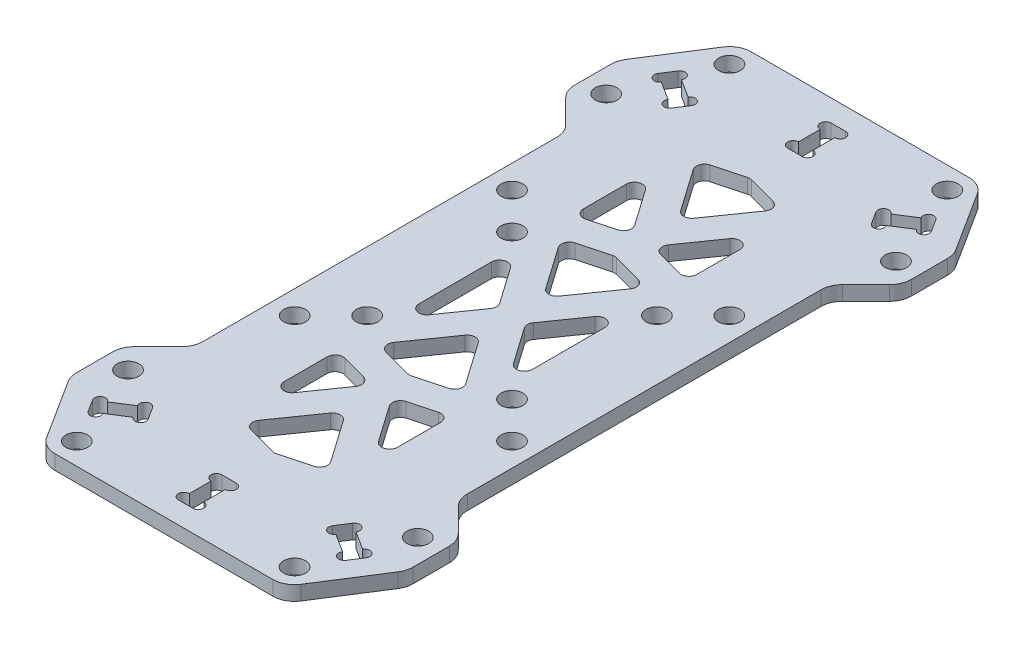
from build123d import *

# Parameters (mm, degrees)
SKETCH11_R               = 1.5
BOSS_EXTRUDE1_DEPTH      = 2
MIRROR11_COPY_1_SKETCH_R = 1.5
MIRROR11_COPY_1_DEPTH    = 2


with BuildPart() as part:
    # Sketch11 → Boss-Extrude1 (new body)
    with BuildSketch(Plane(origin=(0, 0, 0), x_dir=(1, 0, 0), z_dir=(0, 1, 0))):
        with BuildLine():
            Line((0, 48.049), (0, 45.049))
            Line((0, 45.049), (1, 45.049))
            ThreePointArc((1, 45.049), (1.75, 44.299), (1, 43.549))
            Line((1, 43.549), (1, 40.549))
            ThreePointArc((1, 40.549), (1.75, 39.799), (1, 39.049))
            Line((1, 39.049), (0, 39.049))
            Line((0, 39.049), (0, 32.80309693))
            ThreePointArc((0, 32.80309693), (0.143578811, 32.793686277), (0.28470095, 32.765615339))
            Line((0.28470095, 32.765615339), (4.345061591, 31.677644984))
            ThreePointArc((4.345061591, 31.677644984), (5.094022524, 30.991348733), (4.96142789, 29.984192495))
            Line((4.96142789, 29.984192495), (0.901067249, 24.185396539))
            ThreePointArc((0.901067249, 24.185396539), (0.507923475, 23.840618702), (0, 23.716330619))
            Line((0, 23.716330619), (0, 14.172763066))
            ThreePointArc((0, 14.172763066), (0.143578811, 14.163352413), (0.28470095, 14.135281475))
            Line((0.28470095, 14.135281475), (4.34193597, 13.048148628))
            ThreePointArc((4.34193597, 13.048148628), (5.090896903, 12.361852376), (4.958302269, 11.354696139))
            Line((4.958302269, 11.354696139), (0.901067249, 5.560364032))
            ThreePointArc((0.901067249, 5.560364032), (0.507923475, 5.215586196), (0, 5.091298112))
            Line((0, 5.091298112), (0, 0))
            Line((0, 0), (2.133608841, 0))
            ThreePointArc((2.133608841, 0), (2.184520195, 0.330776379), (2.332541592, 0.63093408))
            Line((2.332541592, 0.63093408), (5.833579283, 5.63093408))
            ThreePointArc((5.833579283, 5.63093408), (7.065422911, 6.049088646), (7.834646532, 5))
            Line((7.834646532, 5), (7.834646532, 0))
            Line((7.834646532, 0), (18.23, 0))
            Line((18.23, 0), (18.23, 24.405210912))
            ThreePointArc((18.23, 24.405210912), (18.458361402, 25.553261209), (19.108679656, 26.526531256))
            Line((19.108679656, 26.526531256), (22.351320344, 29.769171943))
            ThreePointArc((22.351320344, 29.769171943), (23.001638598, 30.742441989), (23.23, 31.890492286))
            Line((23.23, 31.890492286), (23.23, 36.890492286))
            ThreePointArc((23.23, 36.890492286), (23.110149563, 37.729979328), (22.760174337, 38.502391111))
            Line((22.760174337, 38.502391111), (17.562631701, 46.660898825))
            ThreePointArc((17.562631701, 46.660898825), (16.47542367, 47.679180267), (15.032457363, 48.049))
            Line((15.032457363, 48.049), (0, 48.049))
        make_face()
        with Locations(Location((15.032457363, 45.049, 0), (0, 0, 270))):
            Circle(SKETCH11_R, mode=Mode.SUBTRACT)
        with Locations(Location((10, 10, 0), (0, 0, 270))):
            Circle(SKETCH11_R, mode=Mode.SUBTRACT)
        with Locations(Location((20, 33, 0), (0, 0, 270))):
            Circle(SKETCH11_R, mode=Mode.SUBTRACT)
        with Locations(Location((15, 15, 0), (0, 0, 270))):
            Circle(SKETCH11_R, mode=Mode.SUBTRACT)
        with BuildLine():
            Line((13.99733048, 38.298608253), (16.527504818, 39.910507078))
            ThreePointArc((16.527504818, 39.910507078), (16.757073696, 40.946025369), (17.792591987, 40.716456491))
            Line((17.792591987, 40.716456491), (18.867191203, 39.029673599))
            ThreePointArc((18.867191203, 39.029673599), (18.637622325, 37.994155308), (17.602104035, 38.223724186))
            Line((17.602104035, 38.223724186), (15.071929697, 36.611825361))
            ThreePointArc((15.071929697, 36.611825361), (14.842360819, 35.576307071), (13.806842528, 35.805875949))
            Line((13.806842528, 35.805875949), (12.732243312, 37.49265884))
            ThreePointArc((12.732243312, 37.49265884), (12.96181219, 38.528177131), (13.99733048, 38.298608253))
        make_face(mode=Mode.SUBTRACT)
        with BuildLine():
            Line((7.834646532, 17.686932285), (7.834646532, 23.625032507))
            ThreePointArc((7.834646532, 23.625032507), (7.065422911, 24.674121152), (5.833579283, 24.255966587))
            Line((5.833579283, 24.255966587), (2.332541592, 19.255966587))
            ThreePointArc((2.332541592, 19.255966587), (2.199946958, 18.248810349), (2.948907891, 17.562514098))
            Line((2.948907891, 17.562514098), (6.449945582, 16.624413876))
            ThreePointArc((6.449945582, 16.624413876), (7.404284104, 16.81424361), (7.834646532, 17.686932285))
        make_face(mode=Mode.SUBTRACT)
    boss_extrude1 = extrude(amount=BOSS_EXTRUDE1_DEPTH)

    # Mirror10: Boss-Extrude1 across plane
    add(boss_extrude1.mirror(Plane(origin=(0, 0, 0), x_dir=(0, 0, 1), z_dir=(1, 0, 0))))

    # Mirror11: Boss-Extrude1 across plane
    add(boss_extrude1.mirror(Plane.XY))

    # Mirror11 copy 1 sketch → Mirror11 copy 1 (add)
    with BuildSketch(Plane(origin=(0, 0, 0), x_dir=(-1, 0, 0), z_dir=(0, 1, 0))):
        with BuildLine():
            Line((0, 48.049), (0, 45.049))
            Line((0, 45.049), (1, 45.049))
            ThreePointArc((1, 45.049), (1.75, 44.299), (1, 43.549))
            Line((1, 43.549), (1, 40.549))
            ThreePointArc((1, 40.549), (1.75, 39.799), (1, 39.049))
            Line((1, 39.049), (0, 39.049))
            Line((0, 39.049), (0, 32.80309693))
            ThreePointArc((0, 32.80309693), (0.143578811, 32.793686277), (0.28470095, 32.765615339))
            Line((0.28470095, 32.765615339), (4.345061591, 31.677644984))
            ThreePointArc((4.345061591, 31.677644984), (5.094022524, 30.991348733), (4.96142789, 29.984192495))
            Line((4.96142789, 29.984192495), (0.901067249, 24.185396539))
            ThreePointArc((0.901067249, 24.185396539), (0.507923475, 23.840618702), (0, 23.716330619))
            Line((0, 23.716330619), (0, 14.172763066))
            ThreePointArc((0, 14.172763066), (0.143578811, 14.163352413), (0.28470095, 14.135281475))
            Line((0.28470095, 14.135281475), (4.34193597, 13.048148628))
            ThreePointArc((4.34193597, 13.048148628), (5.090896903, 12.361852376), (4.958302269, 11.354696139))
            Line((4.958302269, 11.354696139), (0.901067249, 5.560364032))
            ThreePointArc((0.901067249, 5.560364032), (0.507923475, 5.215586196), (0, 5.091298112))
            Line((0, 5.091298112), (0, 0))
            Line((0, 0), (2.133608841, 0))
            ThreePointArc((2.133608841, 0), (2.184520195, 0.330776379), (2.332541592, 0.63093408))
            Line((2.332541592, 0.63093408), (5.833579283, 5.63093408))
            ThreePointArc((5.833579283, 5.63093408), (7.065422911, 6.049088646), (7.834646532, 5))
            Line((7.834646532, 5), (7.834646532, 0))
            Line((7.834646532, 0), (18.23, 0))
            Line((18.23, 0), (18.23, 24.405210912))
            ThreePointArc((18.23, 24.405210912), (18.458361402, 25.553261209), (19.108679656, 26.526531256))
            Line((19.108679656, 26.526531256), (22.351320344, 29.769171943))
            ThreePointArc((22.351320344, 29.769171943), (23.001638598, 30.742441989), (23.23, 31.890492286))
            Line((23.23, 31.890492286), (23.23, 36.890492286))
            ThreePointArc((23.23, 36.890492286), (23.110149563, 37.729979328), (22.760174337, 38.502391111))
            Line((22.760174337, 38.502391111), (17.562631701, 46.660898825))
            ThreePointArc((17.562631701, 46.660898825), (16.47542367, 47.679180267), (15.032457363, 48.049))
            Line((15.032457363, 48.049), (0, 48.049))
        make_face()
        with Locations(Location((15.032457363, 45.049, 0), (0, 0, 270))):
            Circle(MIRROR11_COPY_1_SKETCH_R, mode=Mode.SUBTRACT)
        with Locations(Location((10, 10, 0), (0, 0, 270))):
            Circle(MIRROR11_COPY_1_SKETCH_R, mode=Mode.SUBTRACT)
        with Locations(Location((20, 33, 0), (0, 0, 270))):
            Circle(MIRROR11_COPY_1_SKETCH_R, mode=Mode.SUBTRACT)
        with Locations(Location((15, 15, 0), (0, 0, 270))):
            Circle(MIRROR11_COPY_1_SKETCH_R, mode=Mode.SUBTRACT)
        with BuildLine():
            Line((13.99733048, 38.298608253), (16.527504818, 39.910507078))
            ThreePointArc((16.527504818, 39.910507078), (16.757073696, 40.946025369), (17.792591987, 40.716456491))
            Line((17.792591987, 40.716456491), (18.867191203, 39.029673599))
            ThreePointArc((18.867191203, 39.029673599), (18.637622325, 37.994155308), (17.602104035, 38.223724186))
            Line((17.602104035, 38.223724186), (15.071929697, 36.611825361))
            ThreePointArc((15.071929697, 36.611825361), (14.842360819, 35.576307071), (13.806842528, 35.805875949))
            Line((13.806842528, 35.805875949), (12.732243312, 37.49265884))
            ThreePointArc((12.732243312, 37.49265884), (12.96181219, 38.528177131), (13.99733048, 38.298608253))
        make_face(mode=Mode.SUBTRACT)
        with BuildLine():
            Line((7.834646532, 17.686932285), (7.834646532, 23.625032507))
            ThreePointArc((7.834646532, 23.625032507), (7.065422911, 24.674121152), (5.833579283, 24.255966587))
            Line((5.833579283, 24.255966587), (2.332541592, 19.255966587))
            ThreePointArc((2.332541592, 19.255966587), (2.199946958, 18.248810349), (2.948907891, 17.562514098))
            Line((2.948907891, 17.562514098), (6.449945582, 16.624413876))
            ThreePointArc((6.449945582, 16.624413876), (7.404284104, 16.81424361), (7.834646532, 17.686932285))
        make_face(mode=Mode.SUBTRACT)
    extrude(amount=MIRROR11_COPY_1_DEPTH)


solid = part.part
